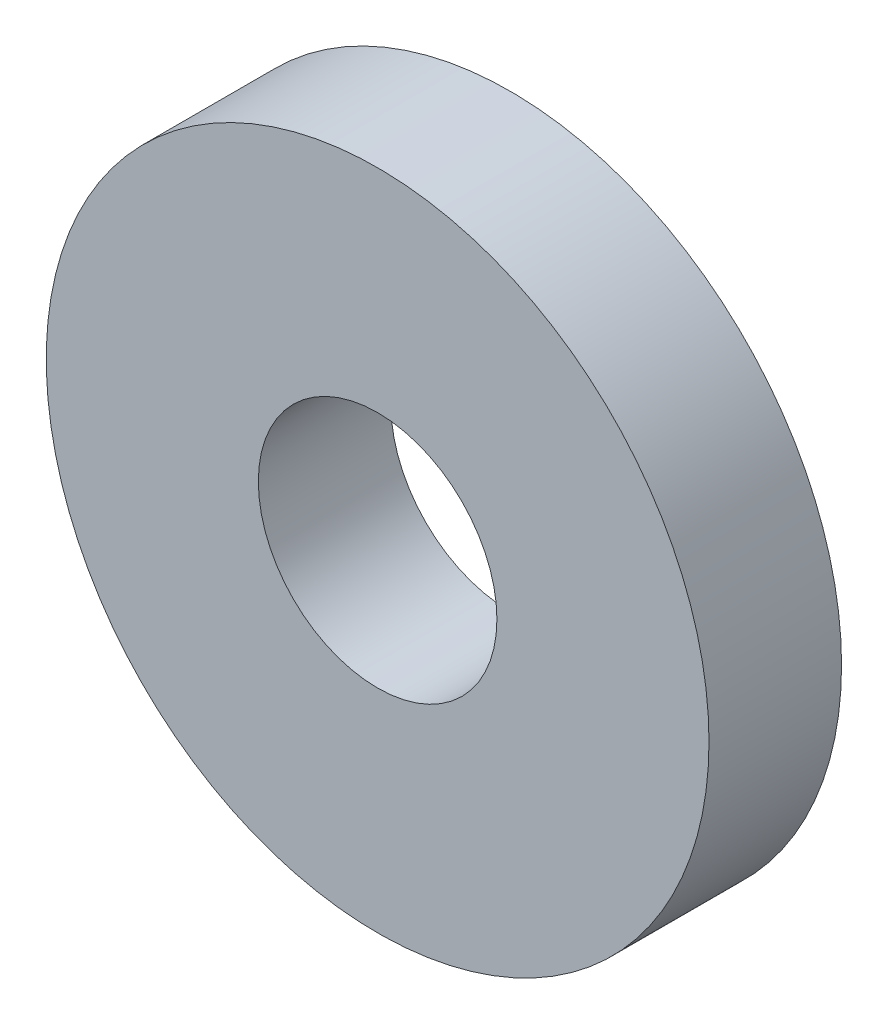
from build123d import *

# Parameters (mm, degrees)
SKETCH_1_R      = 5
SKETCH_1_R_2    = 1.8
EXTRUDE_1_DEPTH = 2


with BuildPart() as part:
    # Эскиз1 → Бобышка-Вытянуть1 (new body)
    with BuildSketch(Plane.XY):
        Circle(SKETCH_1_R)
        Circle(SKETCH_1_R_2, mode=Mode.SUBTRACT)
    extrude(amount=EXTRUDE_1_DEPTH)


solid = part.part
